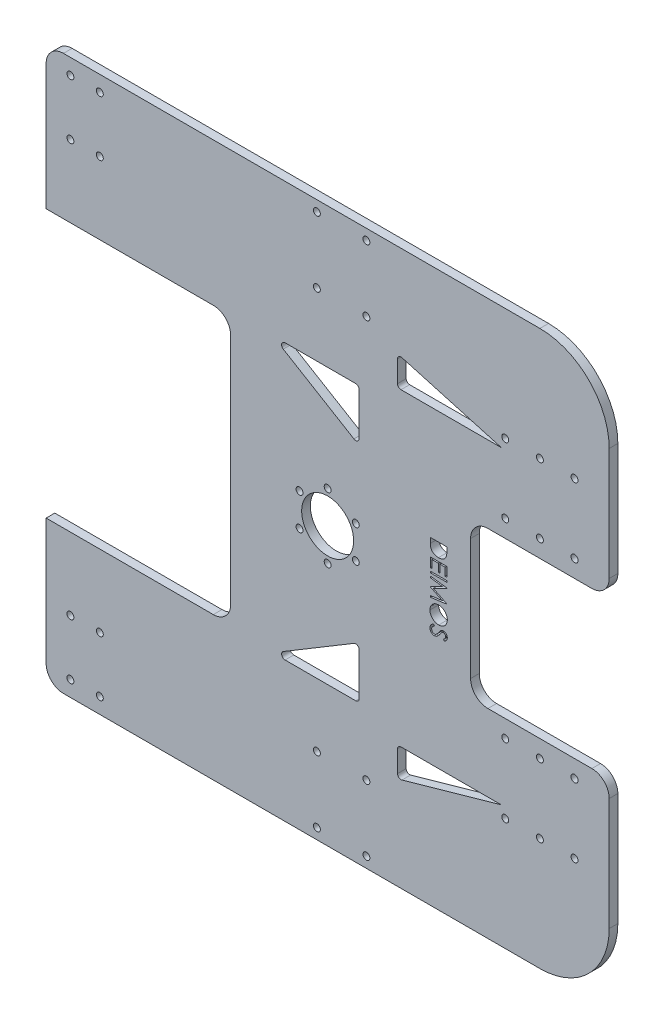
from build123d import *

# Parameters (mm, degrees)
SKETCH1_W           = 325
SKETCH1_H           = 320
SKETCH1_R           = 2
SKETCH1_R_2         = 15
BOSS_EXTRUDE1_DEPTH = 5
FILLET1_R           = 10
FILLET2_R           = 40
SKETCH4_W           = 80
SKETCH4_H           = 90
CUT_EXTRUDE5_DEPTH  = 10
FILLET4_R           = 10
FILLET5_R           = 2
SKETCH8_W           = 9.525
SKETCH8_H           = 0.854807693
CUT_EXTRUDE7_DEPTH  = 34
SKETCH9_R           = 2
CUT_EXTRUDE8_DEPTH  = 10
SKETCH10_W          = 106.502926213
SKETCH10_H          = 154.595526692
CUT_EXTRUDE9_DEPTH  = 10
FILLET6_R           = 10
SKETCH14_R          = 2
CUT_EXTRUDE10_DEPTH = 344.264697074
SKETCH15_R          = 2
SKETCH15_R_2        = 2.072318806
CUT_EXTRUDE11_DEPTH = 344.264697074


with BuildPart() as part:
    # Sketch1 → Boss-Extrude1 (new body)
    with BuildSketch(Plane.XY):
        with Locations((141.153836076, 0)):
            Rectangle(SKETCH1_W, SKETCH1_H)
        with Locations((157.391812397, 9.375)):
            Circle(SKETCH1_R, mode=Mode.SUBTRACT)
        with Locations((141.153836076, 18.75)):
            Circle(SKETCH1_R, mode=Mode.SUBTRACT)
        with Locations((124.915859755, -9.375)):
            Circle(SKETCH1_R, mode=Mode.SUBTRACT)
        with Locations((141.153836076, -18.75)):
            Circle(SKETCH1_R, mode=Mode.SUBTRACT)
        with Locations((157.391812397, -9.375)):
            Circle(SKETCH1_R, mode=Mode.SUBTRACT)
        with Locations((124.915859755, 9.375)):
            Circle(SKETCH1_R, mode=Mode.SUBTRACT)
        with Locations((141.153836076, 0)):
            Circle(SKETCH1_R_2, mode=Mode.SUBTRACT)
    extrude(amount=BOSS_EXTRUDE1_DEPTH)

    # Fillet1
    fillet1_edges = [part.edges().sort_by_distance(p)[0] for p in [
        (-21.346163924, -160, 2.5),
        (-21.346163924, 160, 2.5),
    ]]
    fillet(fillet1_edges, radius=FILLET1_R)

    # Fillet2
    fillet2_edges = [part.edges().sort_by_distance(p)[0] for p in [
        (303.653836076, -160, 2.5),
        (303.653836076, 160, 2.5),
    ]]
    fillet(fillet2_edges, radius=FILLET2_R)

    # Sketch4 → Cut-Extrude5 (cut)
    with BuildSketch(Plane.XY):
        with Locations((263.653836076, 0)):
            Rectangle(SKETCH4_W, SKETCH4_H)
        Polygon((109.344996748, -79.285709175), (159.344996748, -49.285709175), (159.344996748, -79.285709175), align=None)
        Polygon((181.469939285, -89.285709175), (241.469939285, -89.285709175), (181.469939285, -106.285709175), align=None)
        Polygon((159.344996748, 49.285709175), (159.344996748, 79.285709175), (109.344996748, 79.285709175), align=None)
        Polygon((241.469939285, 89.285709175), (181.469939285, 106.285709175), (181.469939285, 89.285709175), align=None)
    extrude(amount=CUT_EXTRUDE5_DEPTH, mode=Mode.SUBTRACT)

    # Fillet4
    fillet4_edges = [part.edges().sort_by_distance(p)[0] for p in [
        (303.653836076, 45, 2.5),
        (223.653836076, 45, 2.5),
        (223.653836076, -45, 2.5),
        (303.653836076, -45, 2.5),
    ]]
    fillet(fillet4_edges, radius=FILLET4_R)

    # Fillet5
    fillet5_edges = [part.edges().sort_by_distance(p)[0] for p in [
        (109.344996748, 79.285709175, 2.5),
        (159.344996748, 49.285709175, 2.5),
        (159.344996748, 79.285709175, 2.5),
        (159.344996748, -79.285709175, 2.5),
        (159.344996748, -49.285709175, 2.5),
        (109.344996748, -79.285709175, 2.5),
        (181.469939285, -106.285709175, 2.5),
        (181.469939285, -89.285709175, 2.5),
        (181.469939285, 89.285709175, 2.5),
        (181.469939285, 106.285709175, 2.5),
    ]]
    fillet(fillet5_edges, radius=FILLET5_R)

    # Sketch8 → Cut-Extrude7 (cut)
    # profile 1 of 6: a face of its own
    with BuildSketch(Plane.XY.offset(5)):
        with BuildLine():
            Line((200.440471707, 23.934615385), (209.965471707, 23.934615385))
            Line((209.965471707, 23.934615385), (209.965471707, 22.011298077))
            add(Edge.make_bspline(
                [(209.965471707, 22.011298077), (209.964270566, 21.844014268), (209.961949968, 21.520822821), (209.947152078, 21.053796461), (209.921238906, 20.622294118), (209.882765221, 20.226560835), (209.836586017, 19.865960835), (209.777857599, 19.541071661), (209.708789002, 19.251366805), (209.649879683, 19.073196747), (209.622022187, 18.988942308)],
                knots=[0, 0, 0, 0, 1.314317071, 2.539253741, 3.67075822, 4.709970291, 5.662644612, 6.526156501, 7.303037452, 8, 8, 8, 8], degree=3))
            add(Edge.make_bspline(
                [(209.622022187, 18.988942308), (209.580028577, 18.878738837), (209.496993632, 18.660830945), (209.340358953, 18.350567689), (209.162883606, 18.05849316), (208.964348832, 17.783018556), (208.739076507, 17.530519725), (208.496845936, 17.290816903), (208.227758902, 17.074670535), (207.94095172, 16.873406548), (207.633514858, 16.697297269), (207.311687884, 16.54198934), (206.976072973, 16.409383485), (206.624227345, 16.305914399), (206.259528694, 16.22043131), (205.879216258, 16.163074194), (205.485507163, 16.124974184), (205.218328935, 16.121164022), (205.082764375, 16.119230769)],
                knots=[0, 0, 0, 0, 0.98467389, 1.947018643, 2.898343565, 3.837828625, 4.779009928, 5.722093987, 6.681368302, 7.658573986, 8.646467994, 9.637429229, 10.641859304, 11.657149908, 12.698561448, 13.768651538, 14.867827761, 16, 16, 16, 16], degree=3))
            add(Edge.make_bspline(
                [(205.082764375, 16.119230769), (204.965032402, 16.120943613), (204.733029254, 16.12431895), (204.391100832, 16.154590077), (204.059342581, 16.19867311), (203.739211546, 16.266610307), (203.42855118, 16.350088741), (203.12883677, 16.453126869), (202.839848629, 16.575237028), (202.56394077, 16.716909335), (202.301569629, 16.871821715), (202.057250154, 17.041674075), (201.82633571, 17.216719714), (201.619241743, 17.410455773), (201.424123862, 17.609531684), (201.251524644, 17.824504057), (201.093925803, 18.048369221), (200.952477694, 18.285439171), (200.829755793, 18.541396111), (200.724622122, 18.819733515), (200.638055098, 19.121942075), (200.565714706, 19.447558579), (200.50836302, 19.797221059), (200.469916507, 20.171250253), (200.443919613, 20.569077959), (200.441643325, 20.842252914), (200.440471707, 20.982857572)],
                knots=[0, 0, 0, 0, 1.105818345, 2.179130549, 3.222742436, 4.24813173, 5.251184997, 6.243232575, 7.223185975, 8.195898781, 9.155064964, 10.083206407, 10.990357329, 11.874224667, 12.744762365, 13.607037788, 14.46074101, 15.315384698, 16.197310979, 17.123950979, 18.107232398, 19.148086642, 20.256146639, 21.433991621, 22.679261309, 24, 24, 24, 24], degree=3))
            Line((200.440471707, 20.982857572), (200.440471707, 23.934615385))
        make_face()
        with BuildLine():
            Line((201.417394783, 23.079807692), (201.417394783, 21.986493389))
            add(Edge.make_bspline(
                [(201.417394783, 21.986493389), (201.41806996, 21.829389752), (201.419368572, 21.527221922), (201.430763746, 21.092724086), (201.44938359, 20.695723729), (201.475441481, 20.336164478), (201.509918212, 20.014249348), (201.548358126, 19.729305571), (201.596248331, 19.48226719), (201.639657728, 19.332780651), (201.6597175, 19.263701923)],
                knots=[0, 0, 0, 0, 1.375205317, 2.645023457, 3.804390687, 4.853969522, 5.800190428, 6.637939096, 7.370582563, 8, 8, 8, 8], degree=3))
            add(Edge.make_bspline(
                [(201.6597175, 19.263701923), (201.69033553, 19.176754899), (201.750840279, 19.004937579), (201.861248055, 18.757637782), (201.99186937, 18.526879566), (202.13792079, 18.30881308), (202.301664229, 18.104850389), (202.483595286, 17.915896311), (202.681701953, 17.740607885), (202.896726347, 17.580902595), (203.127278288, 17.438197506), (203.370422652, 17.31381421), (203.625572617, 17.208276818), (203.893647804, 17.122459669), (204.174395529, 17.055956312), (204.467077202, 17.008639957), (204.771784127, 16.979224867), (204.979025743, 16.975789651), (205.084672428, 16.974038462)],
                knots=[0, 0, 0, 0, 0.998463025, 1.973077781, 2.929496817, 3.867873318, 4.813809365, 5.759268434, 6.706333209, 7.676553387, 8.657505312, 9.640584699, 10.632319813, 11.645628493, 12.686877747, 13.755137172, 14.855624085, 16, 16, 16, 16], degree=3))
            add(Edge.make_bspline(
                [(205.084672428, 16.974038462), (205.196069304, 16.975436825), (205.414909452, 16.978183923), (205.736022157, 17.012655047), (206.044817381, 17.063136613), (206.341517444, 17.135750408), (206.625736331, 17.22956117), (206.899079759, 17.34181335), (207.158030058, 17.478105118), (207.404780437, 17.632401807), (207.635594019, 17.8056281), (207.847766698, 17.99701557), (208.041693703, 18.204546153), (208.217683796, 18.427263407), (208.372607236, 18.668281292), (208.51042471, 18.923521313), (208.627522632, 19.196578866), (208.689781254, 19.386572708), (208.721421226, 19.483128005)],
                knots=[0, 0, 0, 0, 1.122272916, 2.204715076, 3.251197285, 4.274229216, 5.279697671, 6.265416158, 7.248880903, 8.225321784, 9.195852973, 10.153576302, 11.101466393, 12.055578741, 13.010401466, 13.985536859, 14.976245305, 16, 16, 16, 16], degree=3))
            add(Edge.make_bspline(
                [(208.721421226, 19.483128005), (208.743509505, 19.563005053), (208.790475245, 19.732845574), (208.841707152, 20.009994401), (208.88689511, 20.321911343), (208.92515306, 20.669981244), (208.952604985, 21.053807336), (208.973209776, 21.473684816), (208.987107112, 21.929795168), (208.988056094, 22.245977635), (208.98854863, 22.41008113)],
                knots=[0, 0, 0, 0, 0.674548936, 1.434276114, 2.292660221, 3.240891867, 4.284742987, 5.42552168, 6.663806718, 8, 8, 8, 8], degree=3))
            Line((208.98854863, 22.41008113), (208.98854863, 23.079807692))
            Line((208.98854863, 23.079807692), (201.417394783, 23.079807692))
        make_face(mode=Mode.SUBTRACT)
    # profile 2 of 6: a face of its own
    with BuildSketch(Plane.XY.offset(5)):
        Polygon((209.965471707, 14.165384615), (209.965471707, 8.792307692), (208.98854863, 8.792307692), (208.98854863, 13.310576923), (206.057779399, 13.310576923), (206.057779399, 8.792307692), (205.080856322, 8.792307692), (205.080856322, 13.310576923), (201.417394783, 13.310576923), (201.417394783, 8.792307692), (200.440471707, 8.792307692), (200.440471707, 14.165384615), align=None)
    # profile 3 of 6: a face of its own
    with BuildSketch(Plane.XY.offset(5)):
        with Locations((205.202971707, 6.655288462)):
            Rectangle(SKETCH8_W, SKETCH8_H)
    # profile 4 of 6: a face of its own
    with BuildSketch(Plane.XY.offset(5)):
        Polygon((200.440471707, 4.640384615), (209.965471707, 3.382977764), (209.965471707, 3.26086238), (202.150087091, -0.671634615), (209.965471707, -4.592683293), (209.965471707, -4.714798678), (200.440471707, -5.983653846), (200.440471707, -5.128846154), (207.288473509, -4.212980769), (200.440471707, -0.776577524), (200.440471707, -0.58195613), (207.309462091, 2.869711538), (200.440471707, 3.779852764), align=None)
    # profile 5 of 6: a face of its own
    with BuildSketch(Plane.XY.offset(5)):
        with BuildLine():
            add(Edge.make_bspline(
                [(210.209702476, -12.394711538), (210.205235266, -12.571082134), (210.196461298, -12.917488535), (210.129299459, -13.426600011), (210.013104886, -13.912631959), (209.858364071, -14.379554575), (209.651903225, -14.821742714), (209.402495682, -15.242674716), (209.106594281, -15.641160444), (208.769164109, -16.013547296), (208.400688035, -16.353065594), (208.006324048, -16.649700392), (207.591472349, -16.900502873), (207.154689363, -17.106068081), (206.697897528, -17.267481758), (206.218499608, -17.378829993), (205.719645562, -17.449965839), (205.379393603, -17.458281542), (205.206787812, -17.4625)],
                knots=[0, 0, 0, 0, 1.06508495, 2.091914715, 3.094501328, 4.079693967, 5.057647778, 6.035986298, 7.030177474, 8.050107388, 9.066943579, 10.051896531, 11.025616101, 11.9896488, 12.96281505, 13.945825876, 14.957941789, 16, 16, 16, 16], degree=3))
            add(Edge.make_bspline(
                [(205.206787812, -17.4625), (205.035453471, -17.458282168), (204.697733636, -17.449968331), (204.202045381, -17.37874903), (203.725540779, -17.267069316), (203.269061561, -17.107565396), (202.831954548, -16.902987724), (202.416340309, -16.650490184), (202.019245707, -16.3558193), (201.648980849, -16.017474517), (201.308795571, -15.649086315), (201.011699586, -15.25361025), (200.75780913, -14.839166827), (200.553653877, -14.402647885), (200.391097833, -13.948919887), (200.28016285, -13.473824433), (200.208632608, -12.979481442), (200.20041682, -12.642376025), (200.196240937, -12.471033654)],
                knots=[0, 0, 0, 0, 1.04355943, 2.056976533, 3.044937463, 4.02179873, 4.997890911, 5.980248884, 6.980147982, 8.006253959, 9.032111064, 10.031228745, 11.015595249, 11.988180414, 12.962670953, 13.946861971, 14.95644057, 16, 16, 16, 16], degree=3))
            add(Edge.make_bspline(
                [(200.196240937, -12.471033654), (200.200456917, -12.298428563), (200.208767736, -11.958177981), (200.280026672, -11.458699888), (200.391415752, -10.978954853), (200.550753849, -10.520420003), (200.755904397, -10.082944867), (201.008003954, -9.666571754), (201.305068658, -9.270800327), (201.642962978, -8.899658018), (202.011528225, -8.56048412), (202.404404807, -8.262161092), (202.817856242, -8.011514942), (203.250178206, -7.806277791), (203.700253221, -7.643943019), (204.170912427, -7.533157505), (204.659518463, -7.461488875), (204.992193491, -7.453229375), (205.160994543, -7.449038462)],
                knots=[0, 0, 0, 0, 1.053167129, 2.076072758, 3.073341244, 4.055601477, 5.033424535, 6.017524495, 7.021518915, 8.049444456, 9.077120685, 10.074910483, 11.055688766, 12.022980584, 12.991883888, 13.970269434, 14.970104079, 16, 16, 16, 16], degree=3))
            add(Edge.make_bspline(
                [(205.160994543, -7.449038462), (205.274295396, -7.4504921), (205.499467761, -7.453381038), (205.833832819, -7.488212345), (206.162856664, -7.538653118), (206.485433279, -7.611320786), (206.801615339, -7.705055913), (207.110756234, -7.820568555), (207.415402377, -7.952946088), (207.709755812, -8.110559826), (207.994278547, -8.282521132), (208.265412862, -8.470027658), (208.518315566, -8.674386788), (208.7570504, -8.892679298), (208.977542704, -9.127926848), (209.184599716, -9.376588968), (209.37607806, -9.639966771), (209.547956163, -9.918476796), (209.705828289, -10.205018325), (209.837638522, -10.501670229), (209.954141092, -10.802173453), (210.046726087, -11.109174946), (210.120405778, -11.421964563), (210.170469266, -11.740933326), (210.205377968, -12.0657527), (210.208254771, -12.284586812), (210.209702476, -12.394711538)],
                knots=[0, 0, 0, 0, 1.037115869, 2.061148057, 3.07517727, 4.084041727, 5.086514338, 6.092668487, 7.104487461, 8.125783165, 9.147610153, 10.147694368, 11.141876323, 12.122903372, 13.107606018, 14.091946891, 15.084523921, 16.086505767, 17.087268121, 18.077809654, 19.05670789, 20.036870126, 21.011670792, 21.99694167, 22.991993299, 24, 24, 24, 24], degree=3))
        make_face()
        with BuildLine():
            add(Edge.make_bspline(
                [(209.232779399, -12.436688702), (209.231678044, -12.346297243), (209.229485862, -12.166378473), (209.200588195, -11.898907179), (209.159442484, -11.634939073), (209.100600965, -11.374488519), (209.021167049, -11.118957102), (208.927571123, -10.865792994), (208.8174697, -10.6162118), (208.689088699, -10.37300366), (208.548846398, -10.136575097), (208.394925612, -9.911948291), (208.228072694, -9.701364046), (208.050491661, -9.504147785), (207.860375693, -9.320874194), (207.660759057, -9.147828191), (207.445895297, -8.991974404), (207.221621755, -8.849138308), (206.988227605, -8.721318778), (206.748170801, -8.607657324), (206.499492944, -8.514682421), (206.244891989, -8.438856952), (205.984771152, -8.375992468), (205.717157163, -8.336167288), (205.443394751, -8.306959939), (205.258386991, -8.304892074), (205.164810649, -8.303846154)],
                knots=[0, 0, 0, 0, 1.008585988, 2.007529826, 2.999688727, 3.990042337, 4.984966365, 5.984641633, 7.001812546, 8.027570247, 9.052811818, 10.068991095, 11.064725446, 12.050001529, 13.029093193, 14.010961114, 14.996492974, 15.989185205, 16.977398719, 17.96520407, 18.951579521, 19.937648295, 20.929603947, 21.935788061, 22.955928099, 24, 24, 24, 24], degree=3))
            add(Edge.make_bspline(
                [(205.164810649, -8.303846154), (205.027209177, -8.3073156), (204.756504512, -8.314141073), (204.35980692, -8.373897031), (203.978566655, -8.465941119), (203.614869745, -8.601624381), (203.265589947, -8.771307125), (202.933825748, -8.980930305), (202.619487483, -9.229285388), (202.324769643, -9.511398271), (202.055767848, -9.819797922), (201.819647428, -10.147274851), (201.619866677, -10.49032074), (201.457111444, -10.849830171), (201.328143658, -11.22388383), (201.239755383, -11.614892023), (201.181583608, -12.020250059), (201.17599718, -12.296558485), (201.173164014, -12.436688702)],
                knots=[0, 0, 0, 0, 1.032063989, 2.030389145, 3.003944642, 3.970395727, 4.937377036, 5.913328081, 6.909231446, 7.93887556, 8.970685674, 9.976071282, 10.964166581, 11.944589148, 12.933237628, 13.927779006, 14.949070134, 16, 16, 16, 16], degree=3))
            add(Edge.make_bspline(
                [(201.173164014, -12.436688702), (201.174458062, -12.530875991), (201.177024546, -12.717677674), (201.202874573, -12.995523306), (201.244326807, -13.268363573), (201.304010295, -13.535814903), (201.37870304, -13.797577016), (201.467453319, -14.054730356), (201.578124105, -14.304581153), (201.7005984, -14.550110076), (201.839215624, -14.785172856), (201.990984905, -15.008190317), (202.154853841, -15.217869534), (202.330892787, -15.414664661), (202.517584238, -15.599208134), (202.71972834, -15.766488823), (202.931421556, -15.924209713), (203.156218217, -16.066473878), (203.390104195, -16.19403928), (203.631070303, -16.304965307), (203.878288425, -16.399129837), (204.132177562, -16.475131585), (204.392238833, -16.5346923), (204.658824951, -16.575730955), (204.931401392, -16.60443785), (205.115761464, -16.606601586), (205.208695865, -16.607692308)],
                knots=[0, 0, 0, 0, 1.047226202, 2.076964084, 3.100341814, 4.114585567, 5.122123135, 6.126552355, 7.137064942, 8.158803602, 9.176592812, 10.169297945, 11.156925011, 12.133779169, 13.104132798, 14.073170763, 15.049307625, 16.038276215, 17.028988595, 18.010110019, 18.986169996, 19.968539974, 20.955178716, 21.950601663, 22.966915103, 24, 24, 24, 24], degree=3))
            add(Edge.make_bspline(
                [(205.208695865, -16.607692308), (205.300994488, -16.606600707), (205.484085807, -16.604435317), (205.75476132, -16.575744725), (206.019428988, -16.534648731), (206.277049766, -16.475423075), (206.527689324, -16.399086586), (206.771112259, -16.304959637), (207.008225418, -16.193965357), (207.238442755, -16.066580118), (207.459354007, -15.923389913), (207.670543427, -15.766923436), (207.868044966, -15.594479169), (208.056734357, -15.410984051), (208.232587427, -15.211854741), (208.39566191, -14.99799309), (208.549895613, -14.771996064), (208.689024682, -14.5327068), (208.817535419, -14.2857595), (208.92754416, -14.032334828), (209.021571837, -13.774859725), (209.100275827, -13.514652451), (209.159500133, -13.24987995), (209.200573432, -12.982084104), (209.229488956, -12.710807182), (209.231679104, -12.528351486), (209.232779399, -12.436688702)],
                knots=[0, 0, 0, 0, 1.029967493, 2.04313025, 3.035375922, 4.01889446, 4.991458755, 5.958017022, 6.930036849, 7.912118993, 8.892942568, 9.867138445, 10.843712051, 11.817804417, 12.803729339, 13.806387533, 14.818654169, 15.856205545, 16.894655496, 17.924916651, 18.938004761, 19.953404357, 20.957695443, 21.963967554, 22.97713031, 24, 24, 24, 24], degree=3))
        make_face(mode=Mode.SUBTRACT)
    # profile 6 of 6: a face of its own
    with BuildSketch(Plane.XY.offset(5)):
        with BuildLine():
            Line((202.277926634, -18.439423077), (202.760664014, -19.244621394))
            add(Edge.make_bspline(
                [(202.760664014, -19.244621394), (202.635303081, -19.319510311), (202.39511637, -19.462994586), (202.070564132, -19.702347928), (201.794714262, -19.950359636), (201.569171495, -20.208866323), (201.39160131, -20.476290082), (201.265865237, -20.754376685), (201.187444618, -21.042189013), (201.177919382, -21.238060627), (201.173164014, -21.335847356)],
                knots=[0, 0, 0, 0, 1.272034388, 2.437168799, 3.508375237, 4.49857839, 5.41946034, 6.295179144, 7.148887113, 8, 8, 8, 8], degree=3))
            add(Edge.make_bspline(
                [(201.173164014, -21.335847356), (201.175489942, -21.419359463), (201.180101098, -21.584922413), (201.22440818, -21.828659534), (201.292476742, -22.065374772), (201.389961451, -22.290186495), (201.507901867, -22.500003146), (201.650365902, -22.683967297), (201.809831349, -22.843104563), (201.987864337, -22.972921455), (202.178671622, -23.07369915), (202.376278253, -23.146624678), (202.579815023, -23.193037391), (202.71780681, -23.198944798), (202.787376755, -23.201923077)],
                knots=[0, 0, 0, 0, 1.095270387, 2.171376115, 3.241375676, 4.322296363, 5.380636668, 6.392615365, 7.366724986, 8.328592944, 9.273498763, 10.190095884, 11.087518669, 12, 12, 12, 12], degree=3))
            add(Edge.make_bspline(
                [(202.787376755, -23.201923077), (202.866681496, -23.197910846), (203.027896445, -23.189754566), (203.265748358, -23.120816752), (203.501131709, -23.012369873), (203.646731582, -22.912322964), (203.722322668, -22.860381611)],
                knots=[0, 0, 0, 0, 0.938893495, 1.908633276, 2.914225137, 4, 4, 4, 4], degree=3))
            add(Edge.make_bspline(
                [(203.722322668, -22.860381611), (203.776990192, -22.817855884), (203.892094707, -22.728316379), (204.060566022, -22.572251465), (204.238590565, -22.393884351), (204.425445418, -22.192323333), (204.617718146, -21.963561796), (204.819416695, -21.71229708), (205.029934883, -21.437228491), (205.169148506, -21.243372581), (205.241132764, -21.143134014)],
                knots=[0, 0, 0, 0, 0.72226686, 1.520759855, 2.393439377, 3.351307446, 4.386958158, 5.510256019, 6.712608938, 8, 8, 8, 8], degree=3))
            add(Edge.make_bspline(
                [(205.241132764, -21.143134014), (205.31252833, -21.042933507), (205.449031214, -20.851357766), (205.651360372, -20.583236951), (205.837525552, -20.343799379), (206.004933543, -20.131824996), (206.160885832, -19.952797848), (206.297024248, -19.800173202), (206.420618429, -19.679581959), (206.500731761, -19.612475776), (206.536700673, -19.582346755)],
                knots=[0, 0, 0, 0, 1.452255772, 2.776602448, 3.96446981, 5.032613149, 5.964194703, 6.766668629, 7.446264616, 8, 8, 8, 8], degree=3))
            add(Edge.make_bspline(
                [(206.536700673, -19.582346755), (206.592764923, -19.540239328), (206.703022796, -19.457429423), (206.875356873, -19.348120508), (207.051768759, -19.255213215), (207.232732505, -19.182381439), (207.415707562, -19.121050729), (207.603081309, -19.079799504), (207.794012978, -19.053969345), (207.922501147, -19.051324153), (207.986820865, -19.05)],
                knots=[0, 0, 0, 0, 1.068054152, 2.10047183, 3.106115577, 4.101338837, 5.06977816, 6.043150881, 7.020423561, 8, 8, 8, 8], degree=3))
            add(Edge.make_bspline(
                [(207.986820865, -19.05), (208.087603189, -19.053536539), (208.287013686, -19.060534025), (208.578168028, -19.120196234), (208.856990978, -19.213265337), (209.117340916, -19.347870509), (209.358609011, -19.514292343), (209.577109082, -19.710976808), (209.762359255, -19.944496317), (209.922338884, -20.20214099), (210.048649491, -20.482333009), (210.144437234, -20.775414491), (210.197988448, -21.082670611), (210.205759434, -21.29113105), (210.209702476, -21.396905048)],
                knots=[0, 0, 0, 0, 1.005541892, 1.989591032, 2.955705311, 3.932863626, 4.905387107, 5.876519979, 6.856563935, 7.871847665, 8.897921447, 9.918317993, 10.943742853, 12, 12, 12, 12], degree=3))
            add(Edge.make_bspline(
                [(210.209702476, -21.396905048), (210.205903624, -21.509164652), (210.198370047, -21.731788871), (210.130522068, -22.059873542), (210.0209261, -22.376358734), (209.894698127, -22.631113806), (209.769191579, -22.830151271), (209.654829478, -22.981930148), (209.523182496, -23.135739135), (209.373886261, -23.292814468), (209.205574957, -23.450495902), (209.019400091, -23.611123991), (208.816499768, -23.775074471), (208.671653088, -23.880545776), (208.597397788, -23.934615385)],
                knots=[0, 0, 0, 0, 1.286821612, 2.551921131, 3.825787379, 5.12137259, 5.803616487, 6.523126609, 7.299589446, 8.125436757, 9.008162487, 9.944516264, 10.946261234, 12, 12, 12, 12], degree=3))
            Line((208.597397788, -23.934615385), (208.011625553, -23.161853966))
            add(Edge.make_bspline(
                [(208.011625553, -23.161853966), (208.071738348, -23.115192536), (208.187501536, -23.025333532), (208.349620594, -22.888909707), (208.497711231, -22.760325911), (208.626339652, -22.633642244), (208.742551271, -22.515549834), (208.842043366, -22.400930461), (208.925805628, -22.291438311), (209.015150812, -22.153404329), (209.104279244, -21.979544335), (209.178092803, -21.761515036), (209.224046886, -21.534289127), (209.229836564, -21.379950953), (209.232779399, -21.301502404)],
                knots=[0, 0, 0, 0, 1.181667846, 2.275615987, 3.290305621, 4.226321945, 5.078535498, 5.862783384, 6.581873284, 7.217493746, 8.414623899, 9.604724551, 10.782505457, 12, 12, 12, 12], degree=3))
            add(Edge.make_bspline(
                [(209.232779399, -21.301502404), (209.229481844, -21.203105011), (209.22312282, -21.013354907), (209.153672003, -20.743960051), (209.04431994, -20.501497297), (208.89106275, -20.29316496), (208.709486334, -20.119709329), (208.500538164, -19.994236616), (208.269808911, -19.918716526), (208.108859118, -19.909501008), (208.026889976, -19.904807692)],
                knots=[0, 0, 0, 0, 1.14458467, 2.207223713, 3.21896685, 4.227309161, 5.202851033, 6.127160689, 7.046193047, 8, 8, 8, 8], degree=3))
            add(Edge.make_bspline(
                [(208.026889976, -19.904807692), (207.975872177, -19.905927364), (207.873753155, -19.90816854), (207.722483533, -19.937317417), (207.57255668, -19.978649648), (207.423305932, -20.039141915), (207.27122005, -20.120622281), (207.116709648, -20.231411084), (206.95587371, -20.370012438), (206.851370443, -20.476391926), (206.796195865, -20.532557091)],
                knots=[0, 0, 0, 0, 0.858526328, 1.718456515, 2.587092892, 3.476767204, 4.426280253, 5.487868114, 6.673670035, 8, 8, 8, 8], degree=3))
            add(Edge.make_bspline(
                [(206.796195865, -20.532557091), (206.777589388, -20.553406969), (206.733384657, -20.602941506), (206.661015664, -20.693499561), (206.571745263, -20.813086748), (206.46128978, -20.95858031), (206.333160944, -21.132662915), (206.188997042, -21.335353707), (206.024118043, -21.564393308), (205.908845022, -21.726922236), (205.847893582, -21.812860577)],
                knots=[0, 0, 0, 0, 0.420754252, 0.999615792, 1.744751191, 2.668019286, 3.750313428, 4.999500688, 6.413464383, 8, 8, 8, 8], degree=3))
            add(Edge.make_bspline(
                [(205.847893582, -21.812860577), (205.772669596, -21.916236527), (205.627008774, -22.116409726), (205.408163244, -22.401227854), (205.19412896, -22.659474575), (204.986272758, -22.892056579), (204.786171305, -23.101271594), (204.591417221, -23.284798534), (204.40340577, -23.444507421), (204.162361832, -23.616445151), (203.866321881, -23.792134646), (203.503614674, -23.943014748), (203.139497545, -24.038151394), (202.894768083, -24.050592446), (202.774020384, -24.056730769)],
                knots=[0, 0, 0, 0, 1.163667725, 2.253281268, 3.268753668, 4.215851969, 5.092017293, 5.902905408, 6.650798638, 7.335211899, 8.59617414, 9.77448103, 10.901945474, 12, 12, 12, 12], degree=3))
            add(Edge.make_bspline(
                [(202.774020384, -24.056730769), (202.688627078, -24.054941421), (202.519498747, -24.051397473), (202.271144783, -24.010696862), (202.029978611, -23.95099033), (201.798762733, -23.861283074), (201.57440329, -23.750934675), (201.358966951, -23.614638564), (201.155415291, -23.450333689), (200.95951242, -23.267715476), (200.782555808, -23.064765944), (200.624287936, -22.850775085), (200.491818722, -22.624353646), (200.385180663, -22.386597533), (200.300456174, -22.138821965), (200.239557981, -21.880766184), (200.202096526, -21.611711583), (200.19821459, -21.428828661), (200.196240937, -21.335847356)],
                knots=[0, 0, 0, 0, 0.983610584, 1.948120116, 2.894308362, 3.843560551, 4.801159957, 5.773581695, 6.77566113, 7.813174769, 8.857584665, 9.875476876, 10.877851407, 11.875574773, 12.875048225, 13.892438445, 14.928473903, 16, 16, 16, 16], degree=3))
            add(Edge.make_bspline(
                [(200.196240937, -21.335847356), (200.197648022, -21.263908633), (200.20044447, -21.120937182), (200.224581178, -20.910032734), (200.259977953, -20.703001132), (200.313945216, -20.502441906), (200.380963984, -20.30585773), (200.463018769, -20.115000896), (200.56070082, -19.929407707), (200.67417193, -19.748861442), (200.804943386, -19.571660836), (200.956068854, -19.398714345), (201.12650448, -19.228043446), (201.317998122, -19.0627768), (201.528503866, -18.899868111), (201.759785543, -18.74234696), (202.010642557, -18.587005754), (202.18716784, -18.489536147), (202.277926634, -18.439423077)],
                knots=[0, 0, 0, 0, 0.915384692, 1.819241058, 2.699029451, 3.586605375, 4.459625921, 5.340865773, 6.228072412, 7.126546901, 8.052715223, 9.028303326, 10.047266019, 11.120332924, 12.245748783, 13.433636234, 14.680528497, 16, 16, 16, 16], degree=3))
        make_face()
    extrude(amount=-CUT_EXTRUDE7_DEPTH, mode=Mode.SUBTRACT)


with BuildPart() as cut_extrude7_kept_piece:
    # of the separate pieces the step leaves, the one the design keeps (cut_extrude7_pieces_kept)
    add(part.part.solids().sort_by_distance((303.653836076, 55, 0))[0])

    # Sketch9 → Cut-Extrude8 (cut)
    with BuildSketch(Plane.XY.offset(5)):
        with Locations((-7.346163924, -119)):
            Circle(SKETCH9_R)
        with Locations((9.633836076, -119)):
            Circle(SKETCH9_R)
        with Locations((-7.346163924, -151)):
            Circle(SKETCH9_R)
        with Locations((9.633836076, -151)):
            Circle(SKETCH9_R)
        with Locations((9.633836076, 151)):
            Circle(SKETCH9_R)
        with Locations((-7.346163924, 151)):
            Circle(SKETCH9_R)
        with Locations((9.633836076, 119)):
            Circle(SKETCH9_R)
        with Locations((-7.346163924, 119)):
            Circle(SKETCH9_R)
    extrude(amount=-CUT_EXTRUDE8_DEPTH, mode=Mode.SUBTRACT)

    # Sketch10 → Cut-Extrude9 (cut)
    with BuildSketch(Plane.XY.offset(5)):
        with Locations((31.905299182, 0)):
            Rectangle(SKETCH10_W, SKETCH10_H)
    extrude(amount=-CUT_EXTRUDE9_DEPTH, mode=Mode.SUBTRACT)

    # Fillet6
    fillet6_edges = [cut_extrude7_kept_piece.edges().sort_by_distance(p)[0] for p in [
        (85.156762289, 77.297763346, 2.5),
        (85.156762289, -77.297763346, 2.5),
    ]]
    fillet(fillet6_edges, radius=FILLET6_R)

    # Sketch14 → Cut-Extrude10 (cut, through all)
    with BuildSketch(Plane.XY.offset(5)):
        with Locations((134.918098251, 115.87434766)):
            Circle(SKETCH14_R)
        with Locations((163.526675433, 115.87434766)):
            Circle(SKETCH14_R)
        with Locations((134.918098251, 153.87434766)):
            Circle(SKETCH14_R)
        with Locations((163.526675433, 153.87434766)):
            Circle(SKETCH14_R)
        with Locations(Location((163.526675433, -153.87434766, 0), (0, 0, 180))):
            Circle(SKETCH14_R)
        with Locations(Location((134.918098251, -153.87434766, 0), (0, 0, 180))):
            Circle(SKETCH14_R)
        with Locations(Location((163.526675433, -115.87434766, 0), (0, 0, 180))):
            Circle(SKETCH14_R)
        with Locations(Location((134.918098251, -115.87434766, 0), (0, 0, 180))):
            Circle(SKETCH14_R)
    extrude(amount=-CUT_EXTRUDE10_DEPTH, mode=Mode.SUBTRACT)

    # Sketch15 → Cut-Extrude11 (cut, through all)
    with BuildSketch(Plane.XY.offset(5)):
        with Locations((243.653836076, -55)):
            Circle(SKETCH15_R)
        with Locations((283.653836076, -55)):
            Circle(SKETCH15_R_2)
        with Locations((283.653836076, -95)):
            Circle(SKETCH15_R)
        with Locations((263.653836076, -95)):
            Circle(SKETCH15_R)
        with Locations((243.653836076, -95)):
            Circle(SKETCH15_R)
        with Locations((263.653836076, -55)):
            Circle(SKETCH15_R)
        with Locations(Location((263.653836076, 55, 0), (0, 0, 180))):
            Circle(SKETCH15_R)
        with Locations(Location((243.653836076, 95, 0), (0, 0, 180))):
            Circle(SKETCH15_R)
        with Locations(Location((263.653836076, 95, 0), (0, 0, 180))):
            Circle(SKETCH15_R)
        with Locations(Location((283.653836076, 95, 0), (0, 0, 180))):
            Circle(SKETCH15_R)
        with Locations(Location((283.653836076, 55, 0), (0, 0, 180))):
            Circle(SKETCH15_R_2)
        with Locations(Location((243.653836076, 55, 0), (0, 0, 180))):
            Circle(SKETCH15_R)
    extrude(amount=-CUT_EXTRUDE11_DEPTH, mode=Mode.SUBTRACT)


solid = cut_extrude7_kept_piece.part
